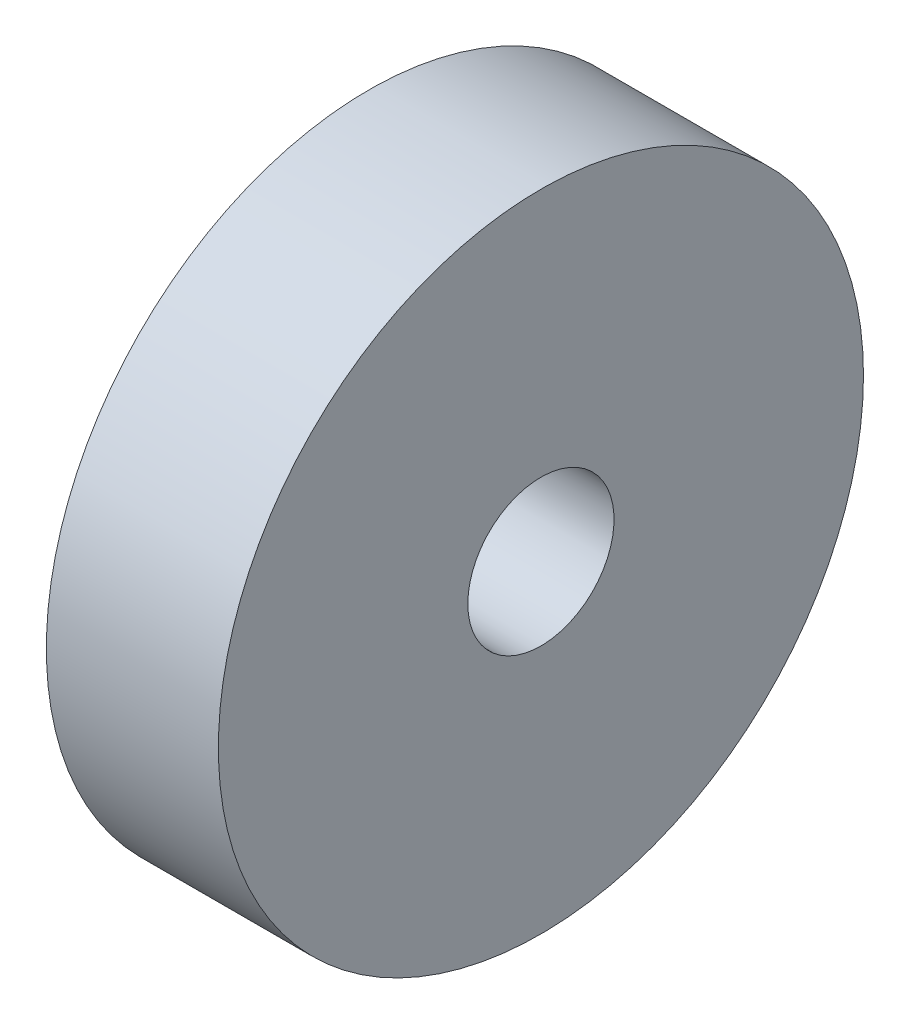
from build123d import *

# Parameters (mm, degrees)
SKETCH1_R           = 37.5
BOSS_EXTRUDE1_DEPTH = 20
SKETCH2_R           = 8.5
CUT_EXTRUDE1_DEPTH  = 57.678920244


with BuildPart() as part:
    # Sketch1 → Boss-Extrude1 (new body)
    with BuildSketch(Plane(origin=(0, 0, 0), x_dir=(0, 0, -1), z_dir=(1, 0, 0))):
        Circle(SKETCH1_R)
    extrude(amount=BOSS_EXTRUDE1_DEPTH)

    # Sketch2 → Cut-Extrude1 (cut, through all)
    with BuildSketch(Plane.ZY):
        Circle(SKETCH2_R)
    extrude(amount=-CUT_EXTRUDE1_DEPTH, mode=Mode.SUBTRACT)


solid = part.part
